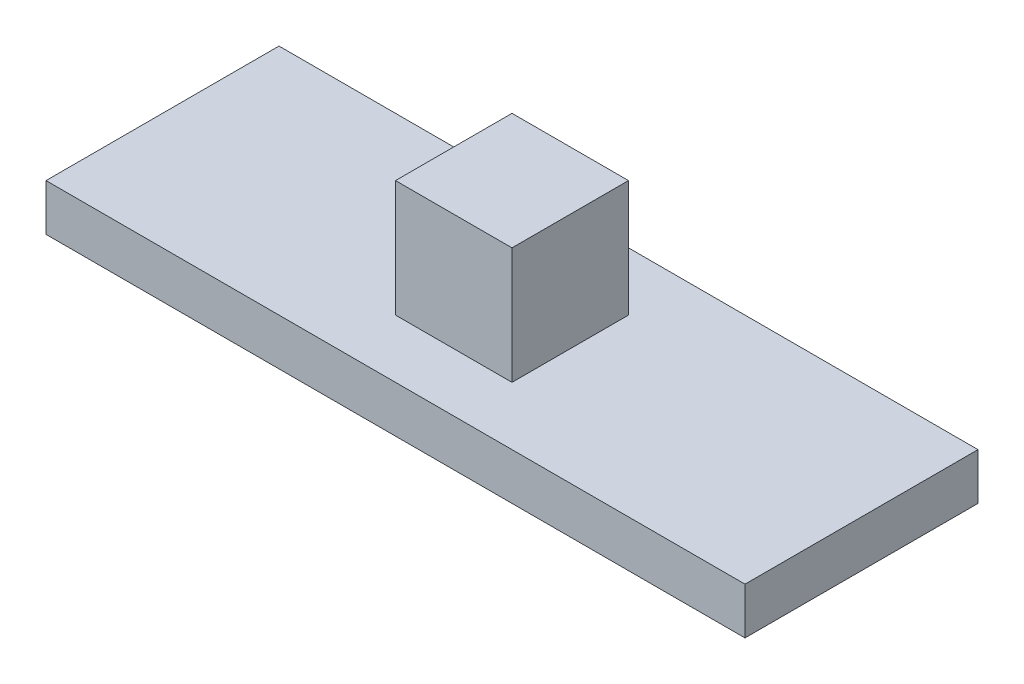
from build123d import *

# Parameters (mm, degrees)
SKETCH1_W           = 30
SKETCH1_H           = 10
BOSS_EXTRUDE1_DEPTH = 2
SKETCH2_W           = 5
SKETCH2_H           = 5
BOSS_EXTRUDE2_DEPTH = 5


with BuildPart() as part:
    # Sketch1 → Boss-Extrude1 (new body)
    with BuildSketch(Plane(origin=(0, 0, 0), x_dir=(1, 0, 0), z_dir=(0, 1, 0))):
        with Locations((15, 5)):
            Rectangle(SKETCH1_W, SKETCH1_H)
    extrude(amount=BOSS_EXTRUDE1_DEPTH)

    # Sketch2 → Boss-Extrude2 (add)
    with BuildSketch(Plane(origin=(0, 2, 0), x_dir=(1, 0, 0), z_dir=(0, 1, 0))):
        with Locations((15, 5)):
            Rectangle(SKETCH2_W, SKETCH2_H)
    extrude(amount=BOSS_EXTRUDE2_DEPTH)


solid = part.part
